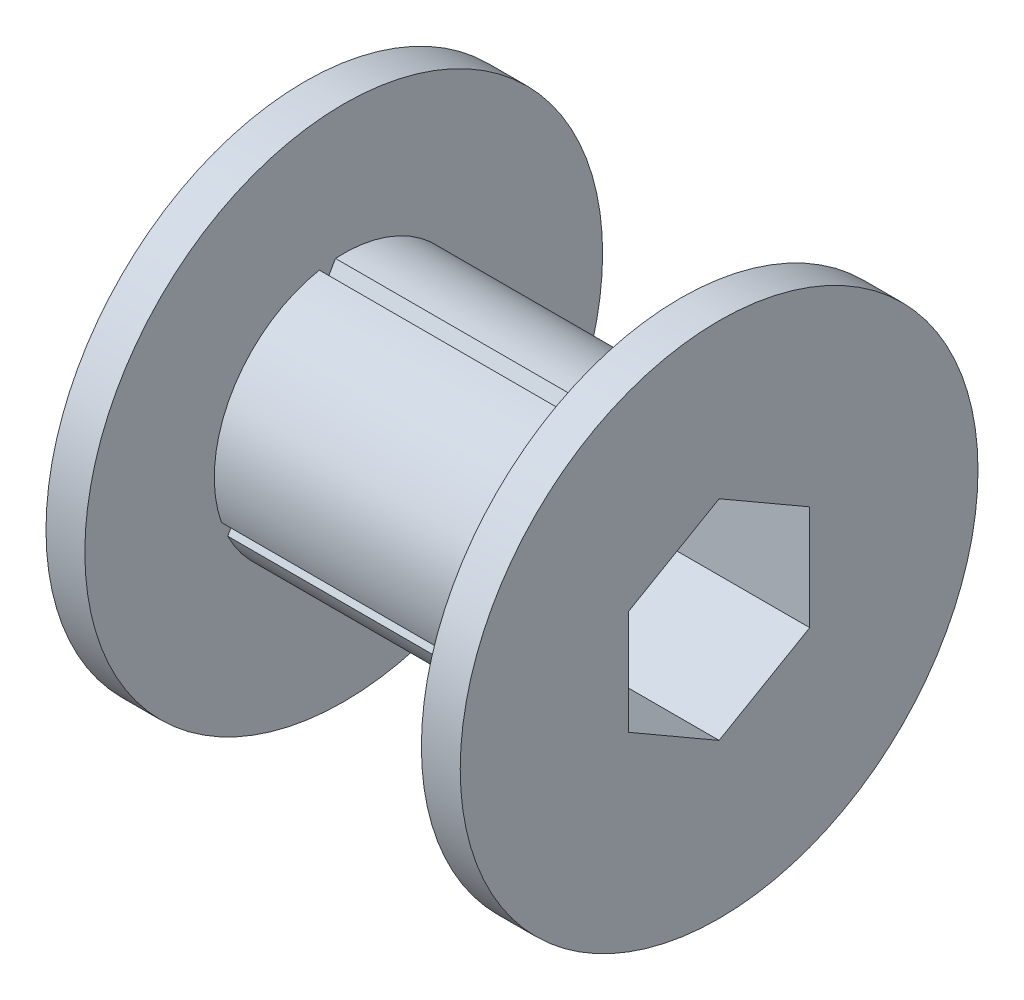
from build123d import *

# Parameters (mm, degrees)
SKETCH1_R               = 2.5
BOSS_EXTRUDE1_DEPTH     = 4
SKETCH2_R               = 5
BOSS_EXTRUDE2_DEPTH     = 0.75
M1_6_NUT_DEPTH          = 9.124038405
M1_6_NUT_DEPTH_BACK     = 9.124038405
CUT_EXTRUDE1_DEPTH      = 10.883671537
CUT_EXTRUDE1_DEPTH_BACK = 10.883671537
SKETCH5_W               = 6.5
SKETCH5_H               = 0.25


with BuildPart() as part:
    # Sketch1 → Boss-Extrude1 (new, symmetric)
    with BuildSketch(Plane(origin=(0, 0, 0), x_dir=(0, 0, -1), z_dir=(1, 0, 0))):
        Circle(SKETCH1_R)
    extrude(amount=BOSS_EXTRUDE1_DEPTH, both=True)

    # Sketch2 → Boss-Extrude2 (add)
    with BuildSketch(Plane(origin=(4, 0, 0), x_dir=(0, 0, -1), z_dir=(1, 0, 0))):
        Circle(SKETCH2_R)
    boss_extrude2 = extrude(amount=-BOSS_EXTRUDE2_DEPTH)

    # Mirror1: Boss-Extrude2 across plane
    add(boss_extrude2.mirror(Plane(origin=(0, 0, 0), x_dir=(0, 0, 1), z_dir=(1, 0, 0))))

    # Sketch3 → M1.6 Nut (cut, two sides: drawn at the far end of the back side and taken through both)
    with BuildSketch(Plane(origin=(0, 0, 0), x_dir=(0, 0, -1), z_dir=(1, 0, 0)).offset(-M1_6_NUT_DEPTH_BACK)):
        Polygon((1.75, 0), (1.75, 1.010362971), (0.875, 1.515544457), (0, 2.020725942), (-0.875, 1.515544457), (-1.75, 1.010362971), (-1.75, 0), (-1.75, -1.010362971), (-0.875, -1.515544457), (0, -2.020725942), (0.875, -1.515544457), (1.75, -1.010362971), align=None)
    extrude(amount=M1_6_NUT_DEPTH + M1_6_NUT_DEPTH_BACK, mode=Mode.SUBTRACT)

    # Sketch5 → Cut-Extrude1 (cut, two sides: drawn at the far end of the back side and taken through both)
    with BuildSketch(Plane(origin=(0, 1.010362971, -1.75), x_dir=(1, 0, 0), z_dir=(0, -0.8660254037844384, 0.5000000000000007)).offset(-CUT_EXTRUDE1_DEPTH_BACK)):
        with Locations((0, 2.520725942)):
            Rectangle(SKETCH5_W, SKETCH5_H)
    extrude(amount=CUT_EXTRUDE1_DEPTH + CUT_EXTRUDE1_DEPTH_BACK, mode=Mode.SUBTRACT)


solid = part.part
